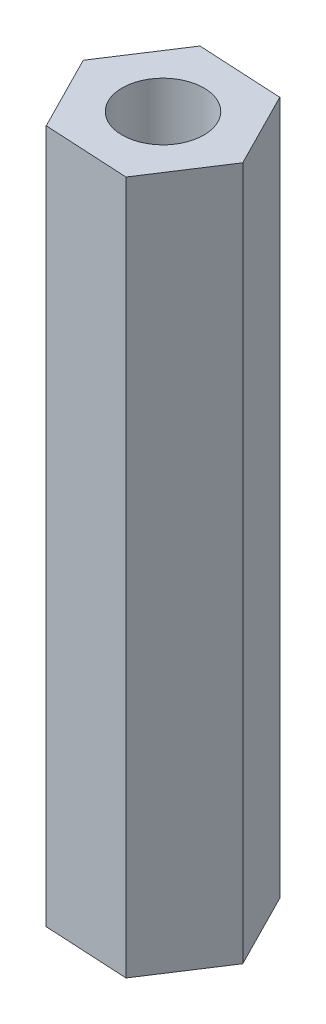
from build123d import *

# Parameters (mm, degrees)
EXTRUDE_1_DEPTH    = 28
HOLE_WIZARD_M4_1_D = 3.3


with BuildPart() as part:
    # 草图1 → 凸台-拉伸1 (new body)
    with BuildSketch(Plane(origin=(0, 0, 0), x_dir=(1, 0, 0), z_dir=(0, 1, 0))):
        Polygon((3.401504202, -0.181940922), (1.858317562, 2.854818589), (-1.54318664, 3.036759511), (-3.401504202, 0.181940922), (-1.858317562, -2.854818589), (1.54318664, -3.036759511), align=None)
    extrude(amount=EXTRUDE_1_DEPTH)

    # M4 螺纹孔1 (through all)
    with Locations(Plane(origin=(0, 28, 0), x_dir=(1, 0, 0), z_dir=(0, 1, 0))):
        with Locations((0, 0)):
            Hole(HOLE_WIZARD_M4_1_D / 2)


solid = part.part
